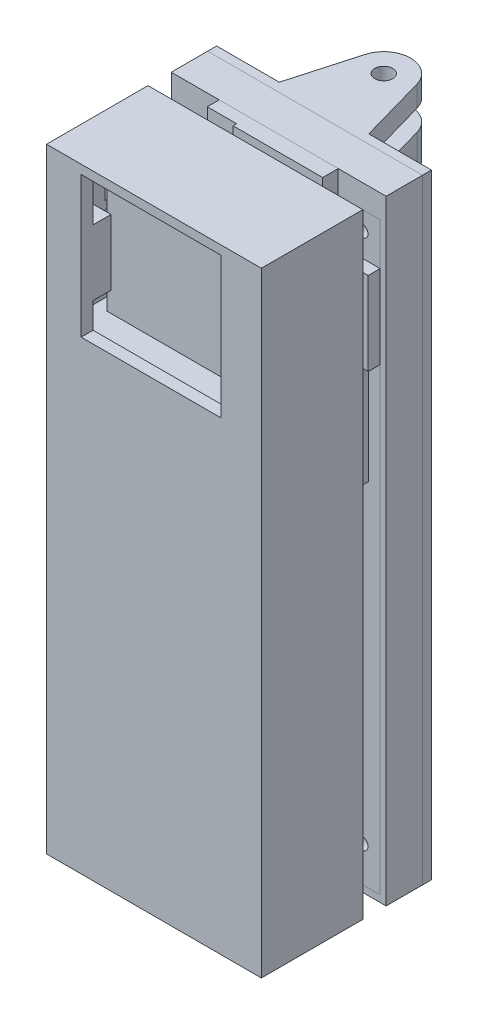
from build123d import *

# Parameters (mm, degrees)
SKETCH1_W                       = 36
SKETCH1_H                       = 103
SKETCH1_W_2                     = 33
SKETCH1_H_2                     = 100
BOSS_EXTRUDE1_DEPTH             = 15
SKETCH2_W                       = 36
SKETCH2_H                       = 103
SKETCH2_W_2                     = 23.4
SKETCH2_H_2                     = 23.6
BOSS_EXTRUDE2_DEPTH             = 2
SKETCH3_W                       = 5.3
SKETCH3_H                       = 11
SKETCH3_R                       = 1
SKETCH3_W_2                     = 4.3
BOSS_EXTRUDE3_DEPTH             = 3
SKETCH4_W                       = 33
SKETCH4_H                       = 1
BOSS_EXTRUDE4_DEPTH             = 10
SKETCH5_W                       = 33
SKETCH5_H                       = 16
CUT_EXTRUDE1_DEPTH              = 1
SKETCH6_W                       = 8.2
SKETCH6_H                       = 6
SKETCH6_W_2                     = 6.8
BOSS_EXTRUDE5_DEPTH             = 4
SKETCH7_W                       = 33
SKETCH7_H                       = 1
BOSS_EXTRUDE6_DEPTH             = 10
SKETCH8_W                       = 36
SKETCH8_H                       = 103
BOSS_EXTRUDE7_DEPTH             = 1.5
SKETCH9_W                       = 24.5
SKETCH9_H                       = 10
SKETCH9_W_2                     = 5.75
SKETCH9_H_2                     = 93
BOSS_EXTRUDE8_DEPTH             = 3
SKETCH10_R                      = 1
CUT_EXTRUDE2_DEPTH              = 60.012710495
SKETCH11_W                      = 34
SKETCH11_H                      = 3.9
SKETCH11_W_2                    = 1
SKETCH11_H_2                    = 98
SKETCH11_H_3                    = 1.1
SKETCH11_W_3                    = 4.75
SKETCH11_W_4                    = 24.5
BOSS_EXTRUDE9_DEPTH             = 1.6
BOSS_EXTRUDE9_DIRECTION_2_REACH = 61.013
SKETCH12_W                      = 34
SKETCH12_H                      = 98
SKETCH12_R                      = 1
BOSS_EXTRUDE10_DEPTH            = 1.6
SKETCH13_W                      = 2.6
SKETCH13_H                      = 52
SKETCH13_W_2                    = 5.08
SKETCH13_H_2                    = 2.6
SKETCH13_W_3                    = 10.16
BOSS_EXTRUDE11_DEPTH            = 8.5
SKETCH14_W                      = 30.04
SKETCH14_H                      = 17.38
SKETCH14_W_2                    = 15.5
SKETCH14_H_2                    = 2.8
BOSS_EXTRUDE12_DEPTH            = 2
SKETCH16_W                      = 12.7
SKETCH16_H                      = 2.54
BOSS_EXTRUDE13_DEPTH            = 2.54
SKETCH17_W                      = 22.1
SKETCH17_H                      = 16
BOSS_EXTRUDE14_DEPTH            = 1.6
SKETCH18_W                      = 4.7
SKETCH18_H                      = 1.95
SKETCH18_W_2                    = 6.54
SKETCH18_W_3                    = 1.5
SKETCH18_H_2                    = 6
BOSS_EXTRUDE15_DEPTH            = 9.04
SKETCH19_W                      = 2.6
SKETCH19_H                      = 1.95
SKETCH19_W_2                    = 5.14
BOSS_EXTRUDE16_DEPTH            = 1.6
SKETCH20_W                      = 10
SKETCH20_H                      = 2.8
BOSS_EXTRUDE17_DEPTH            = 2
SKETCH22_W                      = 7.62
SKETCH22_H                      = 2.54
BOSS_EXTRUDE18_DEPTH            = 2.5
SKETCH23_W                      = 32.8
SKETCH23_H                      = 24.3
SKETCH23_R                      = 1
BOSS_EXTRUDE19_DEPTH            = 1.6
SKETCH25_R                      = 1
BOSS_EXTRUDE20_DEPTH            = 9
SKETCH26_W                      = 23.2
SKETCH26_H                      = 23.8
BOSS_EXTRUDE21_DEPTH            = 3.3
SKETCH27_W                      = 6.6
SKETCH27_H                      = 8.4
BOSS_EXTRUDE22_DEPTH            = 4.5
SKETCH28_W                      = 6.6
SKETCH28_H                      = 8.4
SKETCH28_R                      = 2.25
CUT_EXTRUDE3_DEPTH              = 1.5
SKETCH29_W                      = 15
SKETCH29_H                      = 5
BOSS_EXTRUDE23_DEPTH            = 0.6
SKETCH30_W                      = 36
SKETCH30_H                      = 103
SKETCH30_R                      = 1
BOSS_EXTRUDE24_DEPTH            = 1.5
SKETCH32_R                      = 1.5
BOSS_EXTRUDE25_DEPTH            = 3.5
SKETCH33_R                      = 1.5
BOSS_EXTRUDE26_DEPTH            = 3.5
SKETCH34_R                      = 1.5
BOSS_EXTRUDE27_DEPTH            = 3.5
SKETCH35_R                      = 1.5
BOSS_EXTRUDE28_DEPTH            = 3.5
SKETCH36_W                      = 5.7
SKETCH36_H                      = 5.7
BOSS_EXTRUDE29_DEPTH            = 2
SKETCH37_W                      = 5.7
SKETCH37_H                      = 5.7
BOSS_EXTRUDE30_DEPTH            = 2


with BuildPart() as part:
    # Sketch1 → Boss-Extrude1 (new body)
    with BuildSketch(Plane.XY):
        Rectangle(SKETCH1_W, SKETCH1_H)
        Rectangle(SKETCH1_W_2, SKETCH1_H_2, mode=Mode.SUBTRACT)
    extrude(amount=BOSS_EXTRUDE1_DEPTH)

    # Sketch2 → Boss-Extrude2 (add)
    with BuildSketch(Plane.XY.offset(15)):
        Rectangle(SKETCH2_W, SKETCH2_H)
        with Locations((-0.5, 38.2)):
            Rectangle(SKETCH2_W_2, SKETCH2_H_2, mode=Mode.SUBTRACT)
    extrude(amount=BOSS_EXTRUDE2_DEPTH)

    # Sketch3 → Boss-Extrude3 (add)
    # profile 1 of 2: a face of its own
    with BuildSketch(Plane(origin=(0, 0, 15), x_dir=(-1, 0, 0), z_dir=(0, 0, -1))):
        with Locations((-13.85, 36.2)):
            Rectangle(SKETCH3_W, SKETCH3_H)
        with Locations((-14, 38.2)):
            Circle(SKETCH3_R, mode=Mode.SUBTRACT)
    # profile 2 of 2: a face of its own
    with BuildSketch(Plane(origin=(0, 0, 15), x_dir=(-1, 0, 0), z_dir=(0, 0, -1))):
        with Locations((14.35, 36.2)):
            Rectangle(SKETCH3_W_2, SKETCH3_H)
        with Locations((15, 38.2)):
            Circle(SKETCH3_R, mode=Mode.SUBTRACT)
    extrude(amount=BOSS_EXTRUDE3_DEPTH)

    # Sketch4 → Boss-Extrude4 (add)
    with BuildSketch(Plane(origin=(0, 0, 15), x_dir=(-1, 0, 0), z_dir=(0, 0, -1))):
        with Locations((0, 25.3)):
            Rectangle(SKETCH4_W, SKETCH4_H)
    extrude(amount=BOSS_EXTRUDE4_DEPTH)

    # Sketch5 → Cut-Extrude1 (cut)
    with BuildSketch(Plane(origin=(0, 0, 15), x_dir=(-1, 0, 0), z_dir=(0, 0, -1))):
        with Locations((0, 16.8)):
            Rectangle(SKETCH5_W, SKETCH5_H)
    extrude(amount=-CUT_EXTRUDE1_DEPTH, mode=Mode.SUBTRACT)

    # Sketch6 → Boss-Extrude5 (add)
    with BuildSketch(Plane(origin=(0, 0, 16), x_dir=(-1, 0, 0), z_dir=(0, 0, -1))):
        with Locations((-12.4, 16.8)):
            Rectangle(SKETCH6_W, SKETCH6_H)
        with Locations((13.1, 16.8)):
            Rectangle(SKETCH6_W_2, SKETCH6_H)
    extrude(amount=BOSS_EXTRUDE5_DEPTH)

    # Sketch7 → Boss-Extrude6 (add)
    with BuildSketch(Plane(origin=(0, 0, 15), x_dir=(-1, 0, 0), z_dir=(0, 0, -1))):
        with Locations((0, 8.1)):
            Rectangle(SKETCH7_W, SKETCH7_H)
    extrude(amount=BOSS_EXTRUDE6_DEPTH)


with BuildPart() as body_2:
    # Sketch8 → Boss-Extrude7 (new body)
    with BuildSketch(Plane.XY.offset(-10)):
        Rectangle(SKETCH8_W, SKETCH8_H)
    extrude(amount=BOSS_EXTRUDE7_DEPTH)

    # Sketch9 → Boss-Extrude8 (add)
    with BuildSketch(Plane.XY.offset(-8.5)):
        with Locations((0, 46.5)):
            Rectangle(SKETCH9_W, SKETCH9_H)
        with Locations((-15.125, 46.5)):
            Rectangle(SKETCH9_W_2, SKETCH9_H)
        with Locations((15.125, 46.5)):
            Rectangle(SKETCH9_W_2, SKETCH9_H)
        with Locations((15.125, -5)):
            Rectangle(SKETCH9_W_2, SKETCH9_H_2)
        with Locations((-15.125, -5)):
            Rectangle(SKETCH9_W_2, SKETCH9_H_2)
    extrude(amount=BOSS_EXTRUDE8_DEPTH)

    # Sketch10 → Cut-Extrude2 (cut, through all)
    with BuildSketch(Plane.XY.offset(-5.5)):
        with Locations((-13.97, 44.5)):
            Circle(SKETCH10_R)
        with Locations((13.97, 44.5)):
            Circle(SKETCH10_R)
        with Locations((-13.97, -44.4)):
            Circle(SKETCH10_R)
        with Locations((13.97, -44.4)):
            Circle(SKETCH10_R)
    extrude(amount=-CUT_EXTRUDE2_DEPTH, mode=Mode.SUBTRACT)

    # Sketch11 → Boss-Extrude9 (add)
    with BuildSketch(Plane.XY.offset(-5.5)):
        with Locations((0, 49.55)):
            Rectangle(SKETCH11_W, SKETCH11_H)
        with Locations((17.5, 49.55)):
            Rectangle(SKETCH11_W_2, SKETCH11_H)
        with Locations((17.5, -1.4)):
            Rectangle(SKETCH11_W_2, SKETCH11_H_2)
        with Locations((-17.5, 49.55)):
            Rectangle(SKETCH11_W_2, SKETCH11_H)
        with Locations((-17.5, -1.4)):
            Rectangle(SKETCH11_W_2, SKETCH11_H_2)
        with Locations((-17.5, -50.95)):
            Rectangle(SKETCH11_W_2, SKETCH11_H_3)
        with Locations((-14.625, -50.95)):
            Rectangle(SKETCH11_W_3, SKETCH11_H_3)
        with Locations((0, -50.95)):
            Rectangle(SKETCH11_W_4, SKETCH11_H_3)
        with Locations((14.625, -50.95)):
            Rectangle(SKETCH11_W_3, SKETCH11_H_3)
        with Locations((17.5, -50.95)):
            Rectangle(SKETCH11_W_2, SKETCH11_H_3)
    extrude(amount=BOSS_EXTRUDE9_DEPTH)

    # Boss-Extrude9 direction 2: up to this face of the body (flat: up to its plane)
    boss_extrude9_direction_2_end = Plane(body_2.part.faces().sort_by_distance((0, -5, -8.5))[0])
    # Sketch11 → Boss-Extrude9 direction 2 (add, up to the picked face)
    with BuildSketch(Plane.XY.offset(-5.5), mode=Mode.PRIVATE) as boss_extrude9_direction_2_sk1:
        with Locations((0, 49.55)):
            Rectangle(SKETCH11_W, SKETCH11_H)
    boss_extrude9_direction_2_tool1 = split(extrude(boss_extrude9_direction_2_sk1.sketch, amount=-BOSS_EXTRUDE9_DIRECTION_2_REACH, mode=Mode.PRIVATE), bisect_by=boss_extrude9_direction_2_end, keep=Keep.BOTH, mode=Mode.PRIVATE)
    # Sketch11 → Boss-Extrude9 direction 2 (add, up to the picked face)
    with BuildSketch(Plane.XY.offset(-5.5), mode=Mode.PRIVATE) as boss_extrude9_direction_2_sk2:
        with Locations((17.5, 49.55)):
            Rectangle(SKETCH11_W_2, SKETCH11_H)
    boss_extrude9_direction_2_tool2 = split(extrude(boss_extrude9_direction_2_sk2.sketch, amount=-BOSS_EXTRUDE9_DIRECTION_2_REACH, mode=Mode.PRIVATE), bisect_by=boss_extrude9_direction_2_end, keep=Keep.BOTH, mode=Mode.PRIVATE)
    # Sketch11 → Boss-Extrude9 direction 2 (add, up to the picked face)
    with BuildSketch(Plane.XY.offset(-5.5), mode=Mode.PRIVATE) as boss_extrude9_direction_2_sk3:
        with Locations((17.5, -1.4)):
            Rectangle(SKETCH11_W_2, SKETCH11_H_2)
    boss_extrude9_direction_2_tool3 = split(extrude(boss_extrude9_direction_2_sk3.sketch, amount=-BOSS_EXTRUDE9_DIRECTION_2_REACH, mode=Mode.PRIVATE), bisect_by=boss_extrude9_direction_2_end, keep=Keep.BOTH, mode=Mode.PRIVATE)
    # Sketch11 → Boss-Extrude9 direction 2 (add, up to the picked face)
    with BuildSketch(Plane.XY.offset(-5.5), mode=Mode.PRIVATE) as boss_extrude9_direction_2_sk4:
        with Locations((-17.5, 49.55)):
            Rectangle(SKETCH11_W_2, SKETCH11_H)
    boss_extrude9_direction_2_tool4 = split(extrude(boss_extrude9_direction_2_sk4.sketch, amount=-BOSS_EXTRUDE9_DIRECTION_2_REACH, mode=Mode.PRIVATE), bisect_by=boss_extrude9_direction_2_end, keep=Keep.BOTH, mode=Mode.PRIVATE)
    # Sketch11 → Boss-Extrude9 direction 2 (add, up to the picked face)
    with BuildSketch(Plane.XY.offset(-5.5), mode=Mode.PRIVATE) as boss_extrude9_direction_2_sk5:
        with Locations((-17.5, -1.4)):
            Rectangle(SKETCH11_W_2, SKETCH11_H_2)
    boss_extrude9_direction_2_tool5 = split(extrude(boss_extrude9_direction_2_sk5.sketch, amount=-BOSS_EXTRUDE9_DIRECTION_2_REACH, mode=Mode.PRIVATE), bisect_by=boss_extrude9_direction_2_end, keep=Keep.BOTH, mode=Mode.PRIVATE)
    # Sketch11 → Boss-Extrude9 direction 2 (add, up to the picked face)
    with BuildSketch(Plane.XY.offset(-5.5), mode=Mode.PRIVATE) as boss_extrude9_direction_2_sk6:
        with Locations((-17.5, -50.95)):
            Rectangle(SKETCH11_W_2, SKETCH11_H_3)
    boss_extrude9_direction_2_tool6 = split(extrude(boss_extrude9_direction_2_sk6.sketch, amount=-BOSS_EXTRUDE9_DIRECTION_2_REACH, mode=Mode.PRIVATE), bisect_by=boss_extrude9_direction_2_end, keep=Keep.BOTH, mode=Mode.PRIVATE)
    # Sketch11 → Boss-Extrude9 direction 2 (add, up to the picked face)
    with BuildSketch(Plane.XY.offset(-5.5), mode=Mode.PRIVATE) as boss_extrude9_direction_2_sk7:
        with Locations((-14.625, -50.95)):
            Rectangle(SKETCH11_W_3, SKETCH11_H_3)
    boss_extrude9_direction_2_tool7 = split(extrude(boss_extrude9_direction_2_sk7.sketch, amount=-BOSS_EXTRUDE9_DIRECTION_2_REACH, mode=Mode.PRIVATE), bisect_by=boss_extrude9_direction_2_end, keep=Keep.BOTH, mode=Mode.PRIVATE)
    # Sketch11 → Boss-Extrude9 direction 2 (add, up to the picked face)
    with BuildSketch(Plane.XY.offset(-5.5), mode=Mode.PRIVATE) as boss_extrude9_direction_2_sk8:
        with Locations((0, -50.95)):
            Rectangle(SKETCH11_W_4, SKETCH11_H_3)
    boss_extrude9_direction_2_tool8 = split(extrude(boss_extrude9_direction_2_sk8.sketch, amount=-BOSS_EXTRUDE9_DIRECTION_2_REACH, mode=Mode.PRIVATE), bisect_by=boss_extrude9_direction_2_end, keep=Keep.BOTH, mode=Mode.PRIVATE)
    # Sketch11 → Boss-Extrude9 direction 2 (add, up to the picked face)
    with BuildSketch(Plane.XY.offset(-5.5), mode=Mode.PRIVATE) as boss_extrude9_direction_2_sk9:
        with Locations((14.625, -50.95)):
            Rectangle(SKETCH11_W_3, SKETCH11_H_3)
    boss_extrude9_direction_2_tool9 = split(extrude(boss_extrude9_direction_2_sk9.sketch, amount=-BOSS_EXTRUDE9_DIRECTION_2_REACH, mode=Mode.PRIVATE), bisect_by=boss_extrude9_direction_2_end, keep=Keep.BOTH, mode=Mode.PRIVATE)
    # Sketch11 → Boss-Extrude9 direction 2 (add, up to the picked face)
    with BuildSketch(Plane.XY.offset(-5.5), mode=Mode.PRIVATE) as boss_extrude9_direction_2_sk10:
        with Locations((17.5, -50.95)):
            Rectangle(SKETCH11_W_2, SKETCH11_H_3)
    boss_extrude9_direction_2_tool10 = split(extrude(boss_extrude9_direction_2_sk10.sketch, amount=-BOSS_EXTRUDE9_DIRECTION_2_REACH, mode=Mode.PRIVATE), bisect_by=boss_extrude9_direction_2_end, keep=Keep.BOTH, mode=Mode.PRIVATE)
    add(boss_extrude9_direction_2_tool1.solids().sort_by(Axis((0, 49.55, -5.5), (0, 0, -1)))[0])
    add(boss_extrude9_direction_2_tool2.solids().sort_by(Axis((17.5, 49.55, -5.5), (0, 0, -1)))[0])
    add(boss_extrude9_direction_2_tool3.solids().sort_by(Axis((17.5, -1.4, -5.5), (0, 0, -1)))[0])
    add(boss_extrude9_direction_2_tool4.solids().sort_by(Axis((-17.5, 49.55, -5.5), (0, 0, -1)))[0])
    add(boss_extrude9_direction_2_tool5.solids().sort_by(Axis((-17.5, -1.4, -5.5), (0, 0, -1)))[0])
    add(boss_extrude9_direction_2_tool6.solids().sort_by(Axis((-17.5, -50.95, -5.5), (0, 0, -1)))[0])
    add(boss_extrude9_direction_2_tool7.solids().sort_by(Axis((-14.625, -50.95, -5.5), (0, 0, -1)))[0])
    add(boss_extrude9_direction_2_tool8.solids().sort_by(Axis((0, -50.95, -5.5), (0, 0, -1)))[0])
    add(boss_extrude9_direction_2_tool9.solids().sort_by(Axis((14.625, -50.95, -5.5), (0, 0, -1)))[0])
    add(boss_extrude9_direction_2_tool10.solids().sort_by(Axis((17.5, -50.95, -5.5), (0, 0, -1)))[0])


with BuildPart() as body_3:
    # Sketch12 → Boss-Extrude10 (new body)
    with BuildSketch(Plane.XY.offset(-5.5)):
        with Locations((0, -1.4)):
            Rectangle(SKETCH12_W, SKETCH12_H)
        with Locations((-13.97, 44.5)):
            Circle(SKETCH12_R, mode=Mode.SUBTRACT)
        with Locations((13.97, 44.5)):
            Circle(SKETCH12_R, mode=Mode.SUBTRACT)
        with Locations((13.97, -44.4)):
            Circle(SKETCH12_R, mode=Mode.SUBTRACT)
        with Locations((-13.97, -44.4)):
            Circle(SKETCH12_R, mode=Mode.SUBTRACT)
    extrude(amount=BOSS_EXTRUDE10_DEPTH)

    # Sketch13 → Boss-Extrude11 (add)
    with BuildSketch(Plane.XY.offset(-3.9)):
        with Locations((-8.89, -23.18)):
            Rectangle(SKETCH13_W, SKETCH13_H)
        with Locations((8.89, -23.18)):
            Rectangle(SKETCH13_W, SKETCH13_H)
        with Locations((-1.27, 6.4)):
            Rectangle(SKETCH13_W_2, SKETCH13_H_2)
        with Locations((-1.27, 11.48)):
            Rectangle(SKETCH13_W_3, SKETCH13_H_2)
        with Locations((-1.27, 29.26)):
            Rectangle(SKETCH13_W_2, SKETCH13_H_2)
    extrude(amount=BOSS_EXTRUDE11_DEPTH)


with BuildPart() as body_4:
    # Sketch14 → Boss-Extrude12 (new body)
    with BuildSketch(Plane.XY.offset(-3.9)):
        with Locations((0, 17.27)):
            Rectangle(SKETCH14_W, SKETCH14_H)
        with Locations((-1.27, 11.48)):
            Rectangle(SKETCH14_W_2, SKETCH14_H_2, mode=Mode.SUBTRACT)
    extrude(amount=BOSS_EXTRUDE12_DEPTH)

    # Sketch18 → Boss-Extrude15 (add)
    with BuildSketch(Plane.XY.offset(-1.9)):
        with Locations((-12.67, 24.985)):
            Rectangle(SKETCH18_W, SKETCH18_H)
        with Locations((11.75, 24.985)):
            Rectangle(SKETCH18_W_2, SKETCH18_H)
        with Locations((-1.27, 22.96)):
            Rectangle(SKETCH18_W_3, SKETCH18_H_2)
    extrude(amount=BOSS_EXTRUDE15_DEPTH)

    # Sketch19 → Boss-Extrude16 (add)
    with BuildSketch(Plane.XY.offset(7.14)):
        with Locations((-13.72, 24.985)):
            Rectangle(SKETCH19_W, SKETCH19_H)
        with Locations((12.45, 24.985)):
            Rectangle(SKETCH19_W_2, SKETCH19_H)
    extrude(amount=BOSS_EXTRUDE16_DEPTH)


with BuildPart() as body_5:
    # Sketch16 → Boss-Extrude13 (new body)
    with BuildSketch(Plane.XY.offset(4.6)):
        with Locations((-1.27, 11.48)):
            Rectangle(SKETCH16_W, SKETCH16_H)
    extrude(amount=BOSS_EXTRUDE13_DEPTH)

    # Sketch17 → Boss-Extrude14 (add)
    with BuildSketch(Plane.XY.offset(7.14)):
        with Locations((-1.27, 18.01)):
            Rectangle(SKETCH17_W, SKETCH17_H)
    extrude(amount=BOSS_EXTRUDE14_DEPTH)


with BuildPart() as body_6:
    # Sketch20 → Boss-Extrude17 (new body)
    with BuildSketch(Plane.XY.offset(-3.9)):
        Polygon((-17, 40.5), (-17, 26.56), (17, 26.56), (17, 40.5), (9.97, 40.5), (9.97, 51.5), (-9.97, 51.5), (-9.97, 40.5), align=None)
        with Locations((-1.27, 29.26)):
            Rectangle(SKETCH20_W, SKETCH20_H, mode=Mode.SUBTRACT)
    extrude(amount=BOSS_EXTRUDE17_DEPTH)

    # Sketch25 → Boss-Extrude20 (add)
    # profile 1 of 2: a face of its own
    with BuildSketch(Plane.XY.offset(-1.9)):
        with BuildLine():
            ThreePointArc((-16.98445461, 40.5), (-16.992250843, 40.492438772), (-17, 40.484829306))
            Line((-17, 40.484829306), (-17, 37.995170694))
            ThreePointArc((-17, 37.995170694), (-15.095463122, 37.625224474), (-14.02, 39.24))
            ThreePointArc((-14.02, 39.24), (-14.159441779, 39.924545262), (-14.55554539, 40.5))
            Line((-14.55554539, 40.5), (-16.98445461, 40.5))
        make_face()
        with Locations((-15.77, 39.24)):
            Circle(SKETCH25_R, mode=Mode.SUBTRACT)
    # profile 2 of 2: a face of its own
    with BuildSketch(Plane.XY.offset(-1.9)):
        with BuildLine():
            ThreePointArc((14.98, 39.24), (14.840558221, 39.924545262), (14.44445461, 40.5))
            Line((14.44445461, 40.5), (12.01554539, 40.5))
            ThreePointArc((12.01554539, 40.5), (12.545454738, 37.629441779), (14.98, 39.24))
        make_face()
        with Locations((13.23, 39.24)):
            Circle(SKETCH25_R, mode=Mode.SUBTRACT)
    extrude(amount=BOSS_EXTRUDE20_DEPTH)

    # Sketch29 → Boss-Extrude23 (add)
    with BuildSketch(Plane.XY.offset(-1.9)):
        with Locations((2.47, 49)):
            Rectangle(SKETCH29_W, SKETCH29_H)
    extrude(amount=BOSS_EXTRUDE23_DEPTH)


with BuildPart() as body_7:
    # Sketch22 → Boss-Extrude18 (new body)
    with BuildSketch(Plane.XY.offset(4.6)):
        with Locations((-1.27, 29.26)):
            Rectangle(SKETCH22_W, SKETCH22_H)
    extrude(amount=BOSS_EXTRUDE18_DEPTH)

    # Sketch23 → Boss-Extrude19 (add)
    with BuildSketch(Plane.XY.offset(7.1)):
        with Locations((-1.27, 39.24)):
            Rectangle(SKETCH23_W, SKETCH23_H)
        with Locations((-15.77, 39.24)):
            Circle(SKETCH23_R, mode=Mode.SUBTRACT)
        with Locations((13.23, 39.24)):
            Circle(SKETCH23_R, mode=Mode.SUBTRACT)
    extrude(amount=BOSS_EXTRUDE19_DEPTH)

    # Sketch26 → Boss-Extrude21 (add)
    with BuildSketch(Plane.XY.offset(8.7)):
        with Locations((-1.27, 39.24)):
            Rectangle(SKETCH26_W, SKETCH26_H)
    extrude(amount=BOSS_EXTRUDE21_DEPTH)

    # Sketch27 → Boss-Extrude22 (add)
    with BuildSketch(Plane(origin=(0, 51.39, 0), x_dir=(1, 0, 0), z_dir=(0, 1, 0))):
        with Locations((6.73, -2.9)):
            Rectangle(SKETCH27_W, SKETCH27_H)
        with Locations((-1.57, -2.9)):
            Rectangle(SKETCH27_W, SKETCH27_H)
    extrude(amount=-BOSS_EXTRUDE22_DEPTH)

    # Sketch28 → Cut-Extrude3 (cut)
    # profile 1 of 2: a face of its own
    with BuildSketch(Plane(origin=(0, 51.39, 0), x_dir=(1, 0, 0), z_dir=(0, 1, 0))):
        with Locations((-1.57, -2.9)):
            Rectangle(SKETCH28_W, SKETCH28_H)
        with Locations(Location((-1.57, -2.9, 0), (0, 0, 270))):
            Circle(SKETCH28_R, mode=Mode.SUBTRACT)
    # profile 2 of 2: a face of its own
    with BuildSketch(Plane(origin=(0, 51.39, 0), x_dir=(1, 0, 0), z_dir=(0, 1, 0))):
        with Locations((6.73, -2.9)):
            Rectangle(SKETCH28_W, SKETCH28_H)
        with Locations(Location((6.73, -2.9, 0), (0, 0, 270))):
            Circle(SKETCH28_R, mode=Mode.SUBTRACT)
    extrude(amount=-CUT_EXTRUDE3_DEPTH, mode=Mode.SUBTRACT)


with BuildPart() as body_8:
    # Sketch30 → Boss-Extrude24 (new body)
    with BuildSketch(Plane(origin=(0, 0, -10), x_dir=(-1, 0, 0), z_dir=(0, 0, -1))):
        Rectangle(SKETCH30_W, SKETCH30_H)
        with Locations((-13.97, 44.5)):
            Circle(SKETCH30_R, mode=Mode.SUBTRACT)
        with Locations((13.97, 44.5)):
            Circle(SKETCH30_R, mode=Mode.SUBTRACT)
        with Locations((-13.97, -44.4)):
            Circle(SKETCH30_R, mode=Mode.SUBTRACT)
        with Locations((13.97, -44.4)):
            Circle(SKETCH30_R, mode=Mode.SUBTRACT)
    extrude(amount=BOSS_EXTRUDE24_DEPTH)

    # Sketch32 → Boss-Extrude25 (add)
    with BuildSketch(Plane(origin=(0, 51.5, 0), x_dir=(1, 0, 0), z_dir=(0, 1, 0))):
        with BuildLine():
            Line((-7.5, 11.5), (7.5, 11.5))
            Line((7.5, 11.5), (4.330628291, 22.722971219))
            ThreePointArc((4.330628291, 22.722971219), (0, 26), (-4.330628291, 22.722971219))
            Line((-4.330628291, 22.722971219), (-7.5, 11.5))
        make_face()
        with Locations(Location((0, 21.5, 0), (0, 0, 270))):
            Circle(SKETCH32_R, mode=Mode.SUBTRACT)
    extrude(amount=-BOSS_EXTRUDE25_DEPTH)

    # Sketch33 → Boss-Extrude26 (add)
    with BuildSketch(Plane(origin=(0, 44.5, 0), x_dir=(-1, 0, 0), z_dir=(0, -1, 0))):
        with BuildLine():
            Line((-4.330628291, 22.722971219), (-7.5, 11.5))
            Line((-7.5, 11.5), (7.5, 11.5))
            Line((7.5, 11.5), (4.330628291, 22.722971219))
            ThreePointArc((4.330628291, 22.722971219), (0, 26), (-4.330628291, 22.722971219))
        make_face()
        with Locations(Location((0, 21.5, 0), (0, 0, 270))):
            Circle(SKETCH33_R, mode=Mode.SUBTRACT)
    extrude(amount=BOSS_EXTRUDE26_DEPTH)

    # Sketch34 → Boss-Extrude27 (add)
    with BuildSketch(Plane.XZ.offset(51.5)):
        with BuildLine():
            Line((4.330628291, -22.722971219), (7.5, -11.5))
            Line((7.5, -11.5), (-7.5, -11.5))
            Line((-7.5, -11.5), (-4.330628291, -22.722971219))
            ThreePointArc((-4.330628291, -22.722971219), (0, -26), (4.330628291, -22.722971219))
        make_face()
        with Locations(Location((0, -21.5, 0), (0, 0, 90))):
            Circle(SKETCH34_R, mode=Mode.SUBTRACT)
    extrude(amount=-BOSS_EXTRUDE27_DEPTH)

    # Sketch35 → Boss-Extrude28 (add)
    with BuildSketch(Plane(origin=(0, -44.5, 0), x_dir=(1, 0, 0), z_dir=(0, 1, 0))):
        with BuildLine():
            Line((-4.330628291, 22.722971219), (-7.5, 11.5))
            Line((-7.5, 11.5), (7.5, 11.5))
            Line((7.5, 11.5), (4.330628291, 22.722971219))
            ThreePointArc((4.330628291, 22.722971219), (0, 26), (-4.330628291, 22.722971219))
        make_face()
        with Locations(Location((0, 21.5, 0), (0, 0, 270))):
            Circle(SKETCH35_R, mode=Mode.SUBTRACT)
    extrude(amount=BOSS_EXTRUDE28_DEPTH)

    # Sketch36 → Boss-Extrude29 (add)
    with BuildSketch(Plane(origin=(0, -41, 0), x_dir=(1, 0, 0), z_dir=(0, 1, 0))):
        with BuildLine():
            Line((7.5, 11.5), (4.330628291, 22.722971219))
            ThreePointArc((4.330628291, 22.722971219), (0, 26), (-4.330628291, 22.722971219))
            Line((-4.330628291, 22.722971219), (-7.5, 11.5))
            Line((-7.5, 11.5), (7.5, 11.5))
        make_face()
        with Locations((0, 21.5)):
            Rectangle(SKETCH36_W, SKETCH36_H, mode=Mode.SUBTRACT)
    extrude(amount=BOSS_EXTRUDE29_DEPTH)

    # Sketch37 → Boss-Extrude30 (add)
    with BuildSketch(Plane.XZ.offset(-41)):
        with BuildLine():
            Line((4.330628291, -22.722971219), (7.5, -11.5))
            Line((7.5, -11.5), (-7.5, -11.5))
            Line((-7.5, -11.5), (-4.330628291, -22.722971219))
            ThreePointArc((-4.330628291, -22.722971219), (0, -26), (4.330628291, -22.722971219))
        make_face()
        with Locations((0, -21.5)):
            Rectangle(SKETCH37_W, SKETCH37_H, mode=Mode.SUBTRACT)
    extrude(amount=BOSS_EXTRUDE30_DEPTH)


solid = Compound([part.part, body_2.part, body_3.part, body_4.part, body_5.part, body_6.part, body_7.part, body_8.part])
